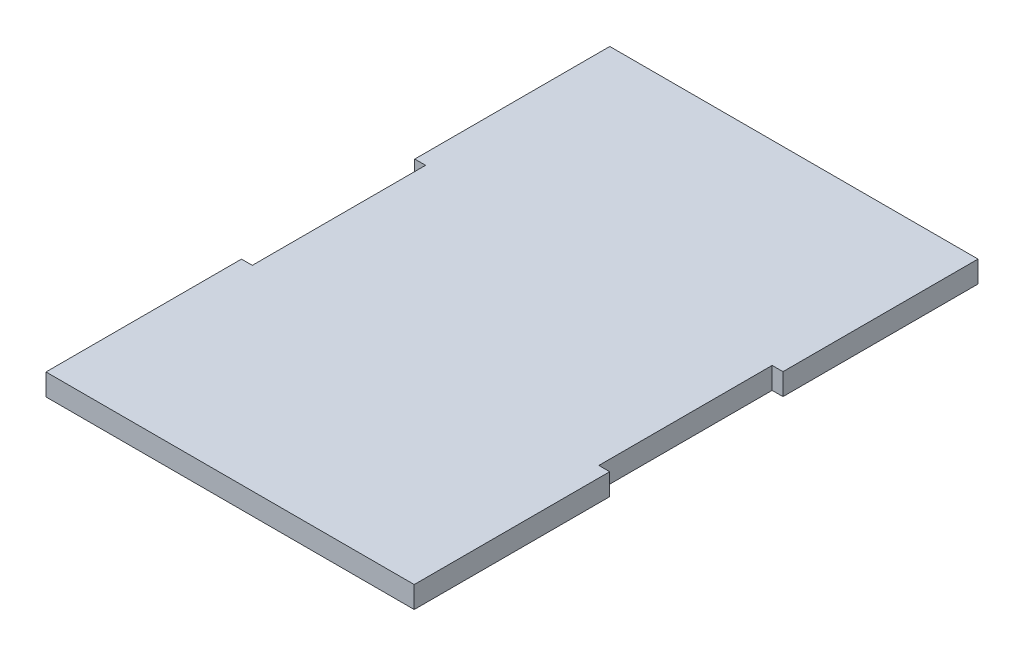
from build123d import *

# Parameters (mm, degrees)
BOSS_EXTRUDE1_DEPTH = 1.5875


with BuildPart() as part:
    # Sketch1 → Boss-Extrude1 (new body)
    with BuildSketch(Plane(origin=(0, 0, 0), x_dir=(1, 0, 0), z_dir=(0, 1, 0))):
        Polygon((-13.49375, -6.334125), (-13.49375, -20.659725), (13.49375, -20.659725), (13.49375, -6.334125), (12.7, -6.334125), (12.7, 6.365875), (13.49375, 6.365875), (13.49375, 20.659725), (-13.49375, 20.659725), (-13.49375, 6.365875), (-12.7, 6.365875), (-12.7, -6.334125), align=None)
    extrude(amount=BOSS_EXTRUDE1_DEPTH)


solid = part.part
